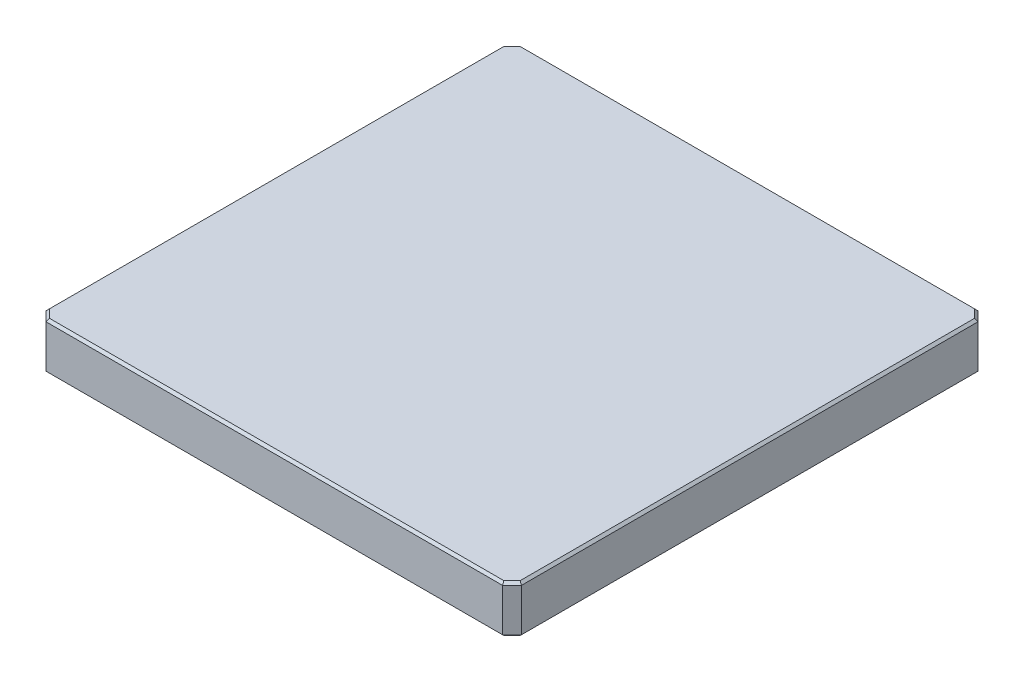
from build123d import *

# Parameters (mm, degrees)
SKETCH1_W           = 100
SKETCH1_H           = 100
BOSS_EXTRUDE1_DEPTH = 10
CHAMFER1_SIZE       = 2
CHAMFER2_SIZE       = 0.5


with BuildPart() as part:
    # Sketch1 → Boss-Extrude1 (new body)
    with BuildSketch(Plane(origin=(0, 0, 0), x_dir=(1, 0, 0), z_dir=(0, 1, 0))):
        with Locations((50, 50)):
            Rectangle(SKETCH1_W, SKETCH1_H)
    extrude(amount=BOSS_EXTRUDE1_DEPTH)

    # Chamfer1
    chamfer1_edges = [part.edges().sort_by_distance(p)[0] for p in [
        (0, 5, -100),
        (100, 5, -100),
        (100, 5, 0),
        (0, 5, 0),
    ]]
    chamfer(chamfer1_edges, length=CHAMFER1_SIZE)

    # Chamfer2
    chamfer2_edges = [part.edges().sort_by_distance(p)[0] for p in [
        (0, 0, -50),
        (0, 10, -50),
        (50, 0, -100),
        (100, 0, -50),
        (50, 0, 0),
        (99, 0, -1),
        (1, 0, -1),
        (99, 0, -99),
        (1, 0, -99),
        (50, 10, -100),
        (50, 10, 0),
        (100, 10, -50),
        (99, 10, -1),
        (1, 10, -1),
        (99, 10, -99),
        (1, 10, -99),
    ]]
    chamfer(chamfer2_edges, length=CHAMFER2_SIZE)


solid = part.part
